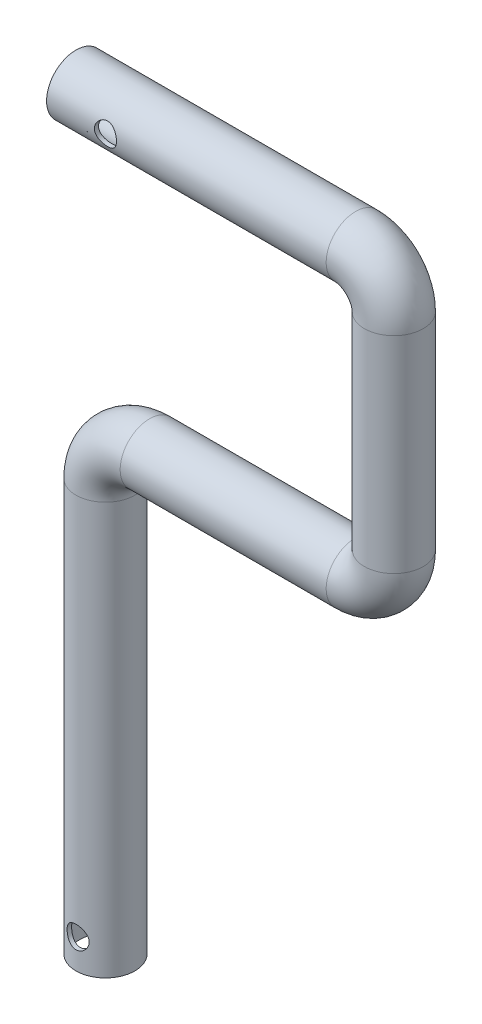
from build123d import *

# Parameters (mm, degrees)
SKETCH1_R           = 6.35
SKETCH1_R_2         = 5.461
BOSS_EXTRUDE1_DEPTH = 88.9
SKETCH5_R           = 6.35
SKETCH5_R_2         = 5.461
REVOLVE2_ANGLE      = 90
SKETCH7_R           = 6.35
SKETCH7_R_2         = 5.461
BOSS_EXTRUDE2_DEPTH = 44.45
SKETCH8_R           = 6.35
SKETCH8_R_2         = 5.461
REVOLVE3_ANGLE      = 90
SKETCH10_R          = 6.35
SKETCH10_R_2        = 5.461
BOSS_EXTRUDE3_DEPTH = 44.45
SKETCH11_R          = 6.35
SKETCH11_R_2        = 5.461
REVOLVE4_ANGLE      = 90
SKETCH13_R          = 6.35
SKETCH13_R_2        = 5.461
BOSS_EXTRUDE4_DEPTH = 60.325
SKETCH14_R          = 2.38125
CUT_EXTRUDE3_DEPTH  = 12.7


with BuildPart() as part:
    # Sketch1 → Boss-Extrude1 (new body)
    with BuildSketch(Plane(origin=(0, 0, 0), x_dir=(1, 0, 0), z_dir=(0, 1, 0))):
        with Locations(Location((0, 0, 0), (0, 0, 270))):
            Circle(SKETCH1_R)
        with Locations(Location((0, 0, 0), (0, 0, 270))):
            Circle(SKETCH1_R_2, mode=Mode.SUBTRACT)
    extrude(amount=BOSS_EXTRUDE1_DEPTH)

    # Sketch5 → Revolve2 (revolve)
    with BuildSketch(Plane(origin=(0, 88.9, 0), x_dir=(1, 0, 0), z_dir=(0, 1, 0))):
        with Locations(Location((0, 0, 0), (0, 0, 180))):
            Circle(SKETCH5_R)
        with Locations(Location((0, 0, 0), (0, 0, 180))):
            Circle(SKETCH5_R_2, mode=Mode.SUBTRACT)
    revolve(axis=Axis((9.525, 88.9, -7.49087288), (0, 0, -1)), revolution_arc=REVOLVE2_ANGLE)

    # Sketch7 → Boss-Extrude2 (add)
    with BuildSketch(Plane(origin=(9.525, 0, 0), x_dir=(0, 0, -1), z_dir=(1, 0, 0))):
        with Locations(Location((0, 98.425, 0), (0, 0, 90))):
            Circle(SKETCH7_R)
        with Locations(Location((0, 98.425, 0), (0, 0, 90))):
            Circle(SKETCH7_R_2, mode=Mode.SUBTRACT)
    extrude(amount=BOSS_EXTRUDE2_DEPTH)

    # Sketch8 → Revolve3 (revolve)
    with BuildSketch(Plane(origin=(53.975, 0, 0), x_dir=(0, 0, -1), z_dir=(1, 0, 0))):
        with Locations(Location((0, 98.425, 0), (0, 0, 270))):
            Circle(SKETCH8_R)
        with Locations(Location((0, 98.425, 0), (0, 0, 270))):
            Circle(SKETCH8_R_2, mode=Mode.SUBTRACT)
    revolve(axis=Axis((53.975, 106.68, 10.204207494), (0, 0, 1)), revolution_arc=REVOLVE3_ANGLE)

    # Sketch10 → Boss-Extrude3 (add)
    with BuildSketch(Plane(origin=(0, 106.68, 0), x_dir=(1, 0, 0), z_dir=(0, 1, 0))):
        with Locations((62.23, 0)):
            Circle(SKETCH10_R)
        with Locations((62.23, 0)):
            Circle(SKETCH10_R_2, mode=Mode.SUBTRACT)
    extrude(amount=BOSS_EXTRUDE3_DEPTH)

    # Sketch11 → Revolve4 (revolve)
    with BuildSketch(Plane(origin=(0, 151.13, 0), x_dir=(1, 0, 0), z_dir=(0, 1, 0))):
        with Locations((62.23, 0)):
            Circle(SKETCH11_R)
        with Locations((62.23, 0)):
            Circle(SKETCH11_R_2, mode=Mode.SUBTRACT)
    revolve(axis=Axis((53.975, 151.13, -10.204207494), (0, 0, 1)), revolution_arc=REVOLVE4_ANGLE)

    # Sketch13 → Boss-Extrude4 (add)
    with BuildSketch(Plane.ZY.offset(-53.975)):
        with Locations(Location((0, 159.385, 0), (0, 0, 90))):
            Circle(SKETCH13_R)
        with Locations(Location((0, 159.385, 0), (0, 0, 90))):
            Circle(SKETCH13_R_2, mode=Mode.SUBTRACT)
    extrude(amount=BOSS_EXTRUDE4_DEPTH)

    # Sketch14 → Cut-Extrude3 (cut, symmetric)
    with BuildSketch(Plane.XY):
        with Locations((6.35, 159.385)):
            Circle(SKETCH14_R)
        with Locations((0, 6.35)):
            Circle(SKETCH14_R)
    extrude(amount=CUT_EXTRUDE3_DEPTH, both=True, mode=Mode.SUBTRACT)


solid = part.part
